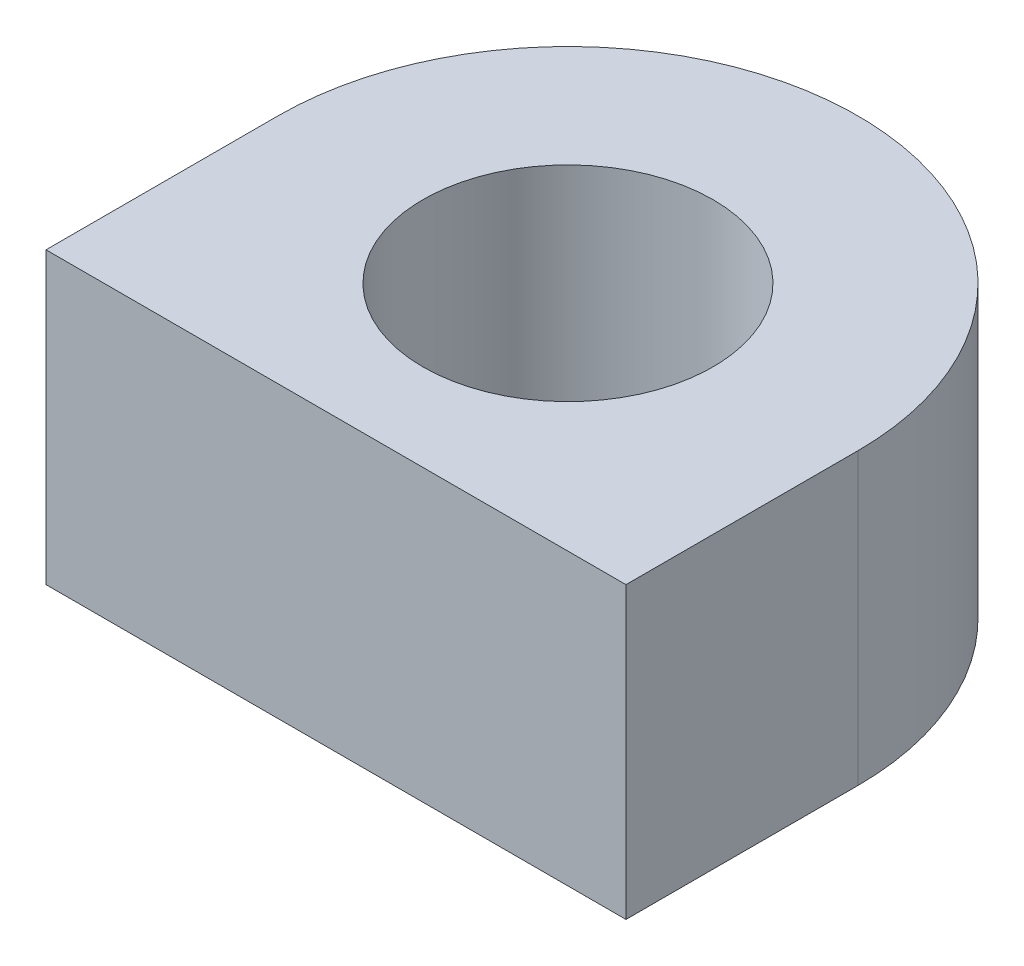
from build123d import *

# Parameters (mm, degrees)
SKETCH1_R           = 5
BOSS_EXTRUDE2_DEPTH = 10


with BuildPart() as part:
    # Sketch1 → Boss-Extrude2 (new body)
    with BuildSketch(Plane(origin=(0, 0, 0), x_dir=(1, 0, 0), z_dir=(0, 1, 0))):
        with BuildLine():
            Line((-10, -8), (-10, 0))
            ThreePointArc((-10, 0), (0, 10), (10, 0))
            Line((10, 0), (10, -8))
            Line((10, -8), (-10, -8))
        make_face()
        with Locations(Location((0, 0, 0), (0, 0, 270))):
            Circle(SKETCH1_R, mode=Mode.SUBTRACT)
    extrude(amount=BOSS_EXTRUDE2_DEPTH)


solid = part.part
